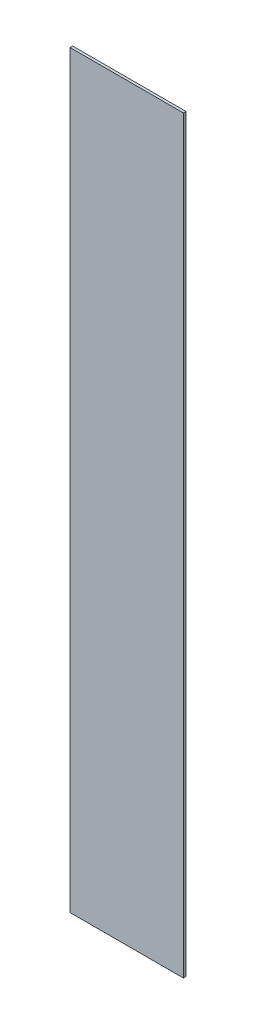
from build123d import *

# Parameters (mm, degrees)
ESBO_O1_W                = 65
ESBO_O1_H                = 430
RESSALTO_EXTRUS_O1_DEPTH = 1.5


with BuildPart() as part:
    # Esboço1 → Ressalto-extrusão1 (new body)
    with BuildSketch(Plane.XY):
        with Locations((32.5, 215)):
            Rectangle(ESBO_O1_W, ESBO_O1_H)
    extrude(amount=RESSALTO_EXTRUS_O1_DEPTH)


solid = part.part
